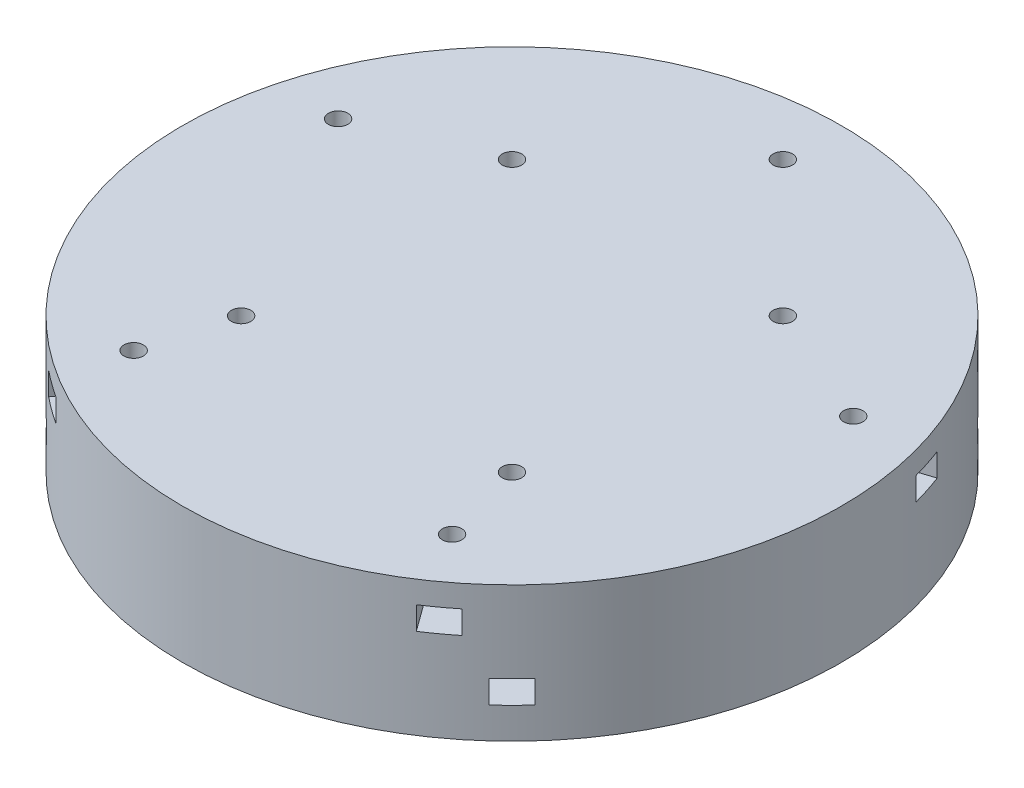
from build123d import *

# Parameters (mm, degrees)
SKETCH1_R           = 73
SKETCH1_R_2         = 2.15
BOSS_EXTRUDE1_DEPTH = 30
CUT_EXTRUDE1_START  = -5.1
CUT_EXTRUDE1_DEPTH  = 5.1
CUT_EXTRUDE2_DEPTH  = 5.1


with BuildPart() as part:
    # Sketch1 → Boss-Extrude1 (new body)
    with BuildSketch(Plane(origin=(0, 0, 0), x_dir=(1, 0, 0), z_dir=(0, 1, 0))):
        with Locations(Location((0, 0, 0), (0, 0, 270))):
            Circle(SKETCH1_R)
        with Locations(Location((30, 30, 0), (0, 0, 270))):
            Circle(SKETCH1_R_2, mode=Mode.SUBTRACT)
        with Locations(Location((-30, 30, 0), (0, 0, 90))):
            Circle(SKETCH1_R_2, mode=Mode.SUBTRACT)
        with Locations(Location((30, -30, 0), (0, 0, 90))):
            Circle(SKETCH1_R_2, mode=Mode.SUBTRACT)
        with Locations(Location((-30, -30, 0), (0, 0, 270))):
            Circle(SKETCH1_R_2, mode=Mode.SUBTRACT)
        with Locations(Location((0, 60, 0), (0, 0, 270))):
            Circle(SKETCH1_R_2, mode=Mode.SUBTRACT)
        with Locations(Location((57.063390978, 18.541019662, 0), (0, 0, 270))):
            Circle(SKETCH1_R_2, mode=Mode.SUBTRACT)
        with Locations(Location((35.267115138, -48.541019662, 0), (0, 0, 270))):
            Circle(SKETCH1_R_2, mode=Mode.SUBTRACT)
        with Locations(Location((-35.267115138, -48.541019662, 0), (0, 0, 270))):
            Circle(SKETCH1_R_2, mode=Mode.SUBTRACT)
        with Locations(Location((-57.063390978, 18.541019662, 0), (0, 0, 270))):
            Circle(SKETCH1_R_2, mode=Mode.SUBTRACT)
    extrude(amount=BOSS_EXTRUDE1_DEPTH)

    # Sketch2 → Cut-Extrude1 (cut)
    with BuildSketch(Plane(origin=(0, 12, 0), x_dir=(1, 0, 0), z_dir=(0, 1, 0)).offset(CUT_EXTRUDE1_START)):
        with BuildLine():
            Line((-27.040199894, 27.040199894), (-25.956837865, 31.083362029))
            Line((-25.956837865, 31.083362029), (-28.916637971, 34.043162135))
            Line((-28.916637971, 34.043162135), (-48.991851025, 54.118375189))
            ThreePointArc((-48.991851025, 54.118375189), (-51.618795027, 51.618795027), (-54.118375189, 48.991851025))
            Line((-54.118375189, 48.991851025), (-34.043162135, 28.916637971))
            Line((-34.043162135, 28.916637971), (-31.083362029, 25.956837865))
            Line((-31.083362029, 25.956837865), (-27.040199894, 27.040199894))
        make_face()
        with BuildLine():
            Line((28.916637971, 34.043162135), (25.956837865, 31.083362029))
            Line((25.956837865, 31.083362029), (27.040199894, 27.040199894))
            Line((27.040199894, 27.040199894), (31.083362029, 25.956837865))
            Line((31.083362029, 25.956837865), (34.043162135, 28.916637971))
            Line((34.043162135, 28.916637971), (54.118375189, 48.991851025))
            ThreePointArc((54.118375189, 48.991851025), (51.618795027, 51.618795027), (48.991851025, 54.118375189))
            Line((48.991851025, 54.118375189), (28.916637971, 34.043162135))
        make_face()
        with BuildLine():
            Line((34.043162135, -28.916637971), (31.083362029, -25.956837865))
            Line((31.083362029, -25.956837865), (27.040199894, -27.040199894))
            Line((27.040199894, -27.040199894), (25.956837865, -31.083362029))
            Line((25.956837865, -31.083362029), (28.916637971, -34.043162135))
            Line((28.916637971, -34.043162135), (48.991851025, -54.118375189))
            ThreePointArc((48.991851025, -54.118375189), (51.618795027, -51.618795027), (54.118375189, -48.991851025))
            Line((54.118375189, -48.991851025), (34.043162135, -28.916637971))
        make_face()
        with BuildLine():
            Line((-28.916637971, -34.043162135), (-25.956837865, -31.083362029))
            Line((-25.956837865, -31.083362029), (-27.040199894, -27.040199894))
            Line((-27.040199894, -27.040199894), (-31.083362029, -25.956837865))
            Line((-31.083362029, -25.956837865), (-34.043162135, -28.916637971))
            Line((-34.043162135, -28.916637971), (-54.118375189, -48.991851025))
            ThreePointArc((-54.118375189, -48.991851025), (-51.618795027, -51.618795027), (-48.991851025, -54.118375189))
            Line((-48.991851025, -54.118375189), (-28.916637971, -34.043162135))
        make_face()
    extrude(amount=CUT_EXTRUDE1_DEPTH, mode=Mode.SUBTRACT)

    # Sketch4 → Cut-Extrude2 (cut)
    with BuildSketch(Plane(origin=(0, 20, 0), x_dir=(1, 0, 0), z_dir=(0, 1, 0))):
        with BuildLine():
            Line((-3.625, 62.092894726), (-3.625, 72.909940166))
            ThreePointArc((-3.625, 72.909940166), (0, 73), (3.625, 72.909940166))
            Line((3.625, 72.909940166), (3.625, 62.092894726))
            Line((3.625, 62.092894726), (3.625, 57.907105274))
            Line((3.625, 57.907105274), (0, 55.814210548))
            Line((0, 55.814210548), (-3.625, 57.907105274))
            Line((-3.625, 57.907105274), (-3.625, 62.092894726))
        make_face()
        with BuildLine():
            Line((56.193116415, 14.446699753), (60.174038749, 15.740179829))
            Line((60.174038749, 15.740179829), (70.461660302, 19.082830699))
            ThreePointArc((70.461660302, 19.082830699), (69.42712569, 22.558240589), (68.221287093, 25.977990442))
            Line((68.221287093, 25.977990442), (57.93366554, 22.635339572))
            Line((57.93366554, 22.635339572), (53.952743206, 21.341859496))
            Line((53.952743206, 21.341859496), (53.082468644, 17.247539587))
            Line((53.082468644, 17.247539587), (56.193116415, 14.446699753))
        make_face()
        with BuildLine():
            Line((31.104255879, -48.978553801), (33.564601187, -52.364928603))
            Line((33.564601187, -52.364928603), (39.92270097, -61.116102193))
            ThreePointArc((39.92270097, -61.116102193), (42.908323417, -59.058240589), (45.78807418, -56.854659114))
            Line((45.78807418, -56.854659114), (39.429974397, -48.103485524))
            Line((39.429974397, -48.103485524), (36.969629088, -44.717110722))
            Line((36.969629088, -44.717110722), (32.806769829, -45.154644861))
            Line((32.806769829, -45.154644861), (31.104255879, -48.978553801))
        make_face()
        with BuildLine():
            Line((-36.969629088, -44.717110722), (-39.429974397, -48.103485524))
            Line((-39.429974397, -48.103485524), (-45.78807418, -56.854659114))
            ThreePointArc((-45.78807418, -56.854659114), (-42.908323417, -59.058240589), (-39.92270097, -61.116102193))
            Line((-39.92270097, -61.116102193), (-33.564601187, -52.364928603))
            Line((-33.564601187, -52.364928603), (-31.104255879, -48.978553801))
            Line((-31.104255879, -48.978553801), (-32.806769829, -45.154644861))
            Line((-32.806769829, -45.154644861), (-36.969629088, -44.717110722))
        make_face()
        with BuildLine():
            Line((-53.952743206, 21.341859496), (-57.93366554, 22.635339572))
            Line((-57.93366554, 22.635339572), (-68.221287093, 25.977990442))
            ThreePointArc((-68.221287093, 25.977990442), (-69.42712569, 22.558240589), (-70.461660302, 19.082830699))
            Line((-70.461660302, 19.082830699), (-60.174038749, 15.740179829))
            Line((-60.174038749, 15.740179829), (-56.193116415, 14.446699753))
            Line((-56.193116415, 14.446699753), (-53.082468644, 17.247539587))
            Line((-53.082468644, 17.247539587), (-53.952743206, 21.341859496))
        make_face()
    extrude(amount=CUT_EXTRUDE2_DEPTH, mode=Mode.SUBTRACT)


solid = part.part
